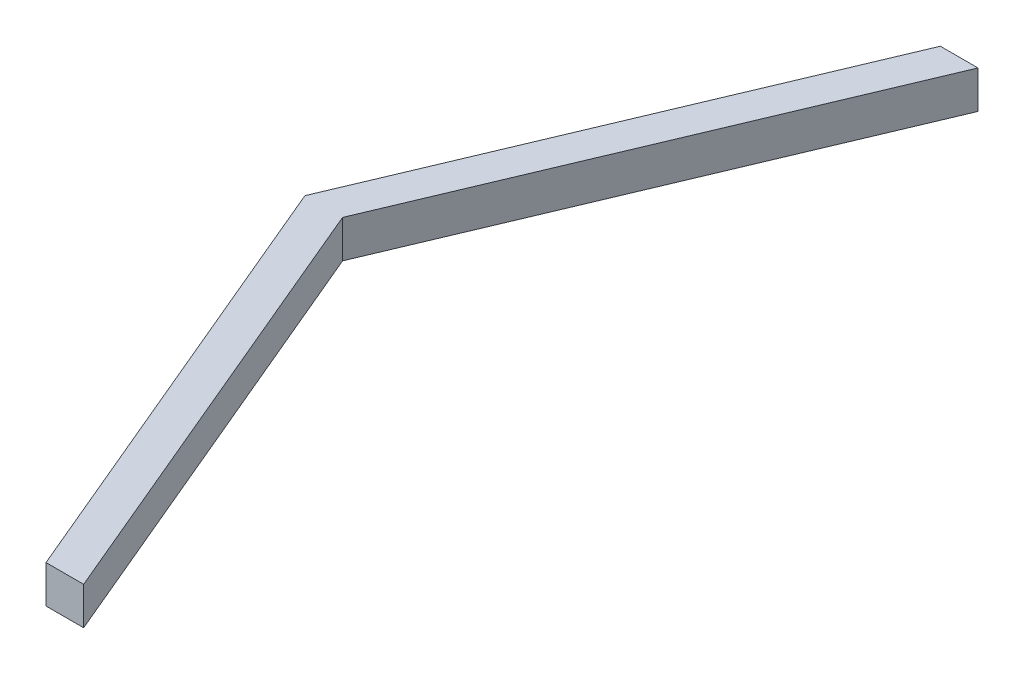
from build123d import *

# Parameters (mm, degrees)
BOSS_EXTRUDE1_DEPTH = 25.4


with BuildPart() as part:
    # Sketch1 → Boss-Extrude1 (new body)
    with BuildSketch(Plane(origin=(0, 0, 0), x_dir=(1, 0, 0), z_dir=(0, 1, 0))):
        Polygon((0, 301.625), (-25.4, 301.625), (-152.4, 0), (-25.4, -301.625), (0, -301.625), (-127, 0), align=None)
    extrude(amount=BOSS_EXTRUDE1_DEPTH)


solid = part.part
